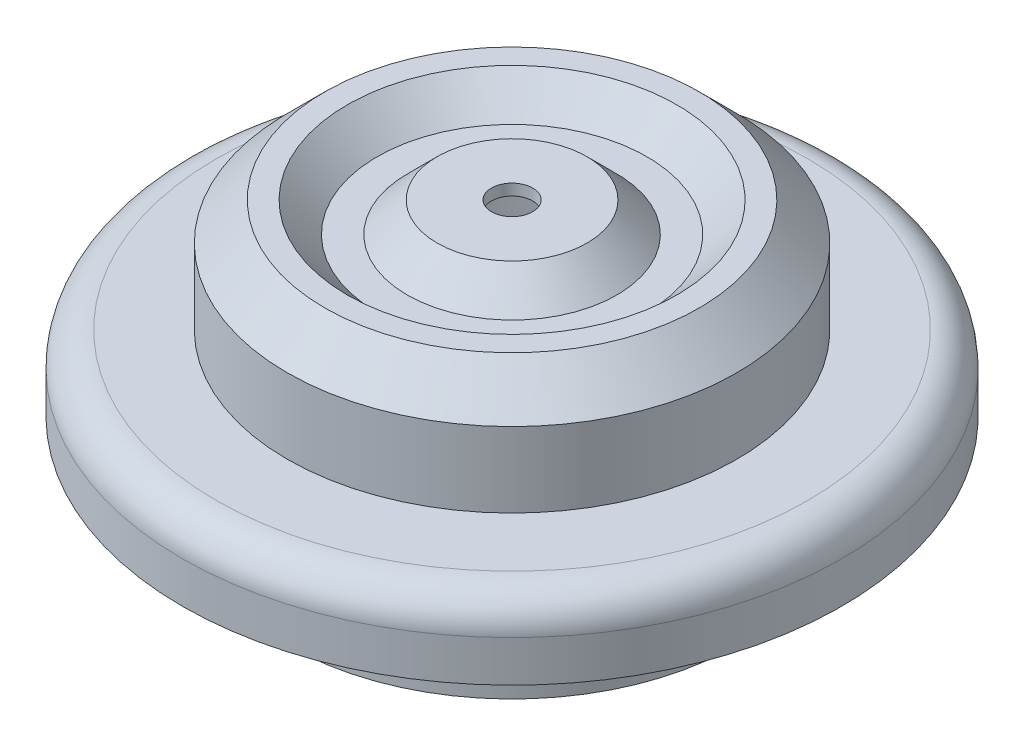
from build123d import *

# Parameters (mm, degrees)
SKETCH_2_R          = 2.75
CUT_EXTRUDE_1_DEPTH = 68.059674917
SKETCH_3_R          = 30
SKETCH_3_R_2        = 28.5
EXTRUDE_1_DEPTH     = 20


with BuildPart() as part:
    # Эскиз1 → Повернуть2 (revolve)
    with BuildSketch(Plane.XY, mode=Mode.PRIVATE) as revolve_2_sk:
        with BuildLine():
            Line((0, 0), (10, 0))
            Line((10, 0), (14, -4))
            Line((14, -4), (18, -4))
            Line((18, -4), (22, 0))
            Line((22, 0), (25, 0))
            Line((25, 0), (30, -5))
            Line((30, -5), (30, -15))
            Line((30, -15), (39.5, -15))
            ThreePointArc((39.5, -15), (42.681980515, -16.318019485), (44, -19.5))
            Line((44, -19.5), (44, -25))
            Line((44, -25), (42.5, -25))
            Line((42.5, -25), (42.5, -19.5))
            ThreePointArc((42.5, -19.5), (41.621320344, -17.378679656), (39.5, -16.5))
            Line((39.5, -16.5), (28.5, -16.5))
            Line((28.5, -16.5), (28.5, -5.621320344))
            Line((28.5, -5.621320344), (24.378679656, -1.5))
            Line((24.378679656, -1.5), (22.621320344, -1.5))
            Line((22.621320344, -1.5), (18.621320344, -5.5))
            Line((18.621320344, -5.5), (13.378679656, -5.5))
            Line((13.378679656, -5.5), (9.378679656, -1.5))
            Line((9.378679656, -1.5), (0, -1.5))
            Line((0, -1.5), (0, 0))
        make_face()
    revolve(revolve_2_sk.sketch.rotate(Axis((0, 0, 0), (0, -1, 0)), 90), axis=Axis((0, 0, 0), (0, -1, 0)))

    # Эскиз2 → Вырез-Вытянуть1 (cut, through all)
    with BuildSketch(Plane(origin=(0, 0, 0), x_dir=(1, 0, 0), z_dir=(0, 1, 0))):
        with Locations(Location((0, 0, 0), (0, 0, 270))):
            Circle(SKETCH_2_R)
    extrude(amount=-CUT_EXTRUDE_1_DEPTH, mode=Mode.SUBTRACT)

    # Эскиз3 → Бобышка-Вытянуть1 (add)
    with BuildSketch(Plane.XZ.offset(16.5)):
        with Locations(Location((0, 0, 0), (0, 0, 90))):
            Circle(SKETCH_3_R)
        with Locations(Location((0, 0, 0), (0, 0, 90))):
            Circle(SKETCH_3_R_2, mode=Mode.SUBTRACT)
    extrude(amount=EXTRUDE_1_DEPTH)


solid = part.part
